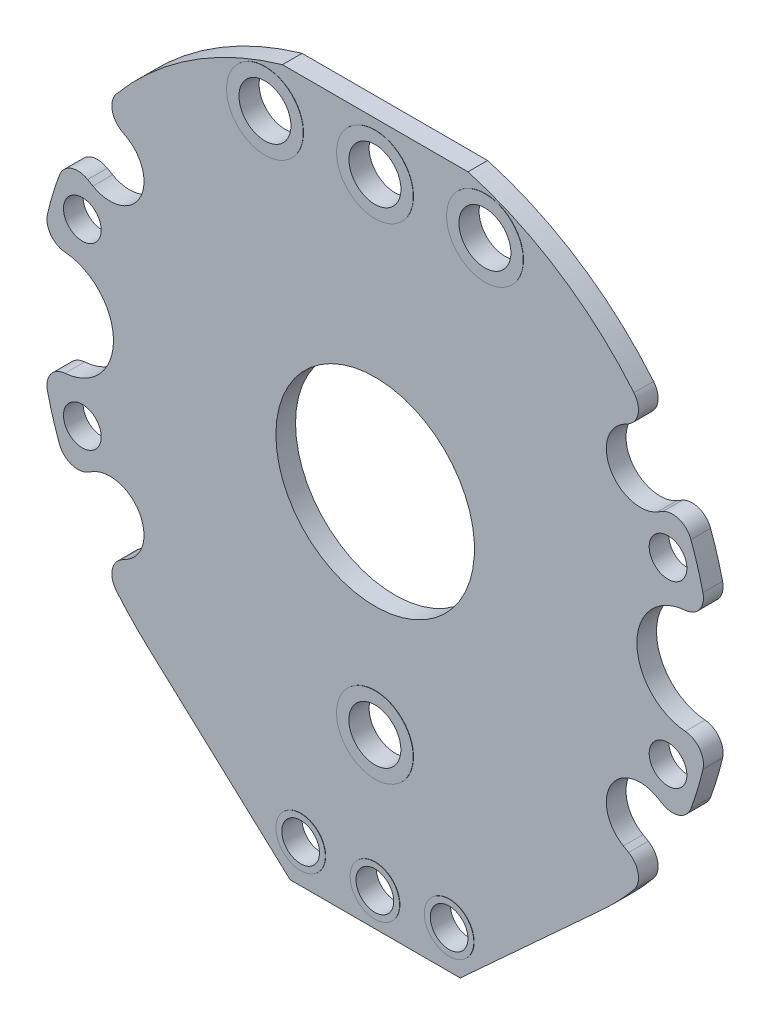
from build123d import *
from build123d.topology import SkipClean

# Parameters (mm, degrees)
BOSS_EXTRUDE1_DEPTH            = 1.5875
CUT_EXTRUDE1_DEPTH             = 46.864987723
CUT_EXTRUDE2_DEPTH             = 46.864987723
CUT_EXTRUDE3_DEPTH             = 46.864987723
CUT_EXTRUDE4_DEPTH             = 46.864987723
SKETCH6_W                      = 3.0988
SKETCH6_H                      = 0.0254
SKETCH10_W                     = 2
SKETCH10_H                     = 0.0254
M14_CLEARANCE_HOLE1_D          = 16.05
M14_CLEARANCE_HOLE1_DEPTH      = 1.6129
F_8_5_8_5_DIAMETER_HOLE1_D     = 8.5
F_8_5_8_5_DIAMETER_HOLE2_D     = 8.5
F_8_5_8_5_DIAMETER_HOLE2_DEPTH = 1.6129
SKETCH17_W                     = 2
SKETCH17_H                     = 0.0254
M2_5_CLEARANCE_HOLE1_D         = 3.048
M3_5_CLEARANCE_HOLE1_D         = 4.2
CHAMFER1_SIZE                  = 9.324286844
FILLET1_R                      = 1.5875
BOSS_EXTRUDE2_START            = 0.02
SKETCH30_R                     = 3.1
SKETCH30_R_2                   = 2.1
BOSS_EXTRUDE2_DEPTH            = 0.02
BOSS_EXTRUDE4_START            = 0.0254
SKETCH33_R                     = 2
SKETCH33_R_2                   = 1.524
BOSS_EXTRUDE4_DEPTH            = 0.0254
SKETCH34_R                     = 2
CUT_EXTRUDE8_DEPTH             = 0.0254
CUT_EXTRUDE9_START             = -0.0254
SKETCH36_R                     = 2
CUT_EXTRUDE9_DEPTH             = 0.0254
BOSS_EXTRUDE5_START            = 0.0254
SKETCH37_R                     = 2
SKETCH37_R_2                   = 1.524
BOSS_EXTRUDE5_DEPTH            = 0.0254
SKETCH38_R                     = 2
SKETCH38_R_2                   = 1.524
BOSS_EXTRUDE6_DEPTH            = 0.02
SKETCH39_R                     = 3.0988
SKETCH39_R_2                   = 2.1
BOSS_EXTRUDE7_DEPTH            = 0.0207


with BuildPart() as part:
    # Sketch1 → Boss-Extrude1 (new body)
    with BuildSketch(Plane(origin=(0, 0, -0.79375), x_dir=(-1, 0, 0), z_dir=(0, 0, -1))):
        with BuildLine():
            Line((-18.376844344, -20.054806456), (0, -36.894081809))
            Line((0, -36.894081809), (18.376844344, -20.054806456))
            ThreePointArc((18.376844344, -20.054806456), (26.47733416, 6.233333445), (7.5, 26.146771695))
            Line((7.5, 26.146771695), (-7.5, 26.146771695))
            ThreePointArc((-7.5, 26.146771695), (-26.47733416, 6.233333445), (-18.376844344, -20.054806456))
        make_face()
    extrude(amount=-BOSS_EXTRUDE1_DEPTH)

    # Sketch2 → Cut-Extrude1 (cut, through all)
    with BuildSketch(Plane.XY.offset(0.79375)):
        with BuildLine():
            Line((-25.071320917, 11.2995074), (-22.809128744, 9.99343014))
            ThreePointArc((-22.809128744, 9.99343014), (-19.052558883, 11), (-20.059128744, 14.75656986))
            Line((-20.059128744, 14.75656986), (-22.321320917, 16.062647121))
            ThreePointArc((-22.321320917, 16.062647121), (-23.815698604, 13.75), (-25.071320917, 11.2995074))
        make_face()
    extrude(amount=-CUT_EXTRUDE1_DEPTH, mode=Mode.SUBTRACT)

    # Sketch3 → Cut-Extrude2 (cut, through all)
    with BuildSketch(Plane.XY.offset(0.79375)):
        with BuildLine():
            Line((22.321320917, 16.062647121), (20.059128744, 14.75656986))
            ThreePointArc((20.059128744, 14.75656986), (19.052558883, 11), (22.809128744, 9.99343014))
            Line((22.809128744, 9.99343014), (25.071320917, 11.2995074))
            ThreePointArc((25.071320917, 11.2995074), (23.815698604, 13.75), (22.321320917, 16.062647121))
        make_face()
    extrude(amount=-CUT_EXTRUDE2_DEPTH, mode=Mode.SUBTRACT)

    # Sketch4 → Cut-Extrude3 (cut, through all)
    with BuildSketch(Plane.XY.offset(0.79375)):
        with BuildLine():
            Line((25.071320917, -11.2995074), (22.809128744, -9.99343014))
            ThreePointArc((22.809128744, -9.99343014), (19.052558883, -11), (20.059128744, -14.75656986))
            Line((20.059128744, -14.75656986), (22.321320917, -16.062647121))
            ThreePointArc((22.321320917, -16.062647121), (23.815698604, -13.75), (25.071320917, -11.2995074))
        make_face()
    extrude(amount=-CUT_EXTRUDE3_DEPTH, mode=Mode.SUBTRACT)

    # Sketch5 → Cut-Extrude4 (cut, through all)
    with BuildSketch(Plane.XY.offset(0.79375)):
        with BuildLine():
            Line((-22.321320917, -16.062647121), (-20.059128744, -14.75656986))
            ThreePointArc((-20.059128744, -14.75656986), (-19.052558883, -11), (-22.809128744, -9.99343014))
            Line((-22.809128744, -9.99343014), (-25.071320917, -11.2995074))
            ThreePointArc((-25.071320917, -11.2995074), (-23.815698604, -13.75), (-22.321320917, -16.062647121))
        make_face()
    extrude(amount=-CUT_EXTRUDE4_DEPTH, mode=Mode.SUBTRACT)

    # Sketch6 → Revolve1 (revolve)
    with BuildSketch(Plane.XZ.offset(17), mode=Mode.PRIVATE) as revolve1_sk:
        with Locations((1.5494, 0.80645)):
            Rectangle(SKETCH6_W, SKETCH6_H)
    revolve(revolve1_sk.sketch.rotate(Axis((0, -17, 0.81915), (0, 0, -1)), 180), axis=Axis((0, -17, 0.81915), (0, 0, -1)))

    # Sketch10 → Revolve5 (revolve)
    with BuildSketch(Plane.XZ.offset(28.575), mode=Mode.PRIVATE) as revolve5_sk:
        with Locations((1, 0.80645)):
            Rectangle(SKETCH10_W, SKETCH10_H)
    revolve(revolve5_sk.sketch.rotate(Axis((0, -28.575, 0.81915), (0, 0, -1)), 180), axis=Axis((0, -28.575, 0.81915), (0, 0, -1)))

    # M14 Clearance Hole1
    with Locations(Plane(origin=(0, 0, -0.79375), x_dir=(-1, 0, 0), z_dir=(0, 0, -1))):
        with Locations((0, 0)):
            Hole(M14_CLEARANCE_HOLE1_D / 2, depth=M14_CLEARANCE_HOLE1_DEPTH)

    # Ø8.5 (8.5) Diameter Hole1 (through all)
    with Locations(Plane.XY.offset(0.79375)):
        with Locations((-25.4, 0)):
            Hole(F_8_5_8_5_DIAMETER_HOLE1_D / 2)

    # Ø8.5 (8.5) Diameter Hole2
    with Locations(Plane(origin=(0, 0, -0.79375), x_dir=(-1, 0, 0), z_dir=(0, 0, -1))):
        with Locations((-25.4, 0)):
            Hole(F_8_5_8_5_DIAMETER_HOLE2_D / 2, depth=F_8_5_8_5_DIAMETER_HOLE2_DEPTH)

    # Sketch17 → Revolve12 (revolve)
    with BuildSketch(Plane.XZ.offset(28.575), mode=Mode.PRIVATE) as revolve12_sk:
        with Locations((1, -0.80645)):
            Rectangle(SKETCH17_W, SKETCH17_H)
    revolve(revolve12_sk.sketch.rotate(Axis((0, -28.575, -0.79375), (0, 0, -1)), 180), axis=Axis((0, -28.575, -0.79375), (0, 0, -1)))

    # M2.5 Clearance Hole1 (through all)
    with Locations(Plane(origin=(0, 0, -0.81915), x_dir=(-1, 0, 0), z_dir=(0, 0, -1))):
        with Locations((0, -27.9), (-6, -27.5), (6, -27.5), (23.66854271, 7.236199692), (23.66854271, -7.236199692), (-23.66854271, -7.236199692), (-23.66854271, 7.236199692)):
            Hole(M2_5_CLEARANCE_HOLE1_D / 2)

    # M3.5 Clearance Hole1 (through all)
    with Locations(Plane(origin=(0, 0, -0.79375), x_dir=(-1, 0, 0), z_dir=(0, 0, -1))):
        with Locations((-8.89, 22.225), (8.89, 22.225), (0, 22.225), (0, -17)):
            Hole(M3_5_CLEARANCE_HOLE1_D / 2)

    # Chamfer1
    chamfer1_edges = [part.edges().sort_by_distance(p)[0] for p in [
        (0, -36.894081809, 0),
    ]]
    chamfer(chamfer1_edges, length=CHAMFER1_SIZE)

    # Fillet1
    fillet1_edges = [part.edges().sort_by_distance(p)[0] for p in [
        (-26.909471851, 3.972907591, 0),
        (-26.909471851, -3.972907591, 0),
        (26.909471851, -3.972907591, 0),
        (26.909471851, 3.972907591, 0),
        (-22.061208685, 15.912471254, 0),
        (-24.811208685, 11.149331533, 0),
        (24.811208685, 11.149331533, 0),
        (22.061208685, 15.912471254, 0),
        (22.061208685, -15.912471254, 0),
        (24.811208685, -11.149331533, 0),
        (-24.811208685, -11.149331533, 0),
        (-22.061208685, -15.912471254, 0),
    ]]
    fillet(fillet1_edges, radius=FILLET1_R)

    # Sketch30 → Boss-Extrude2 (add)
    # profile 1 of 3: a face of its own
    with BuildSketch(Plane.XY.offset(0.79375).offset(BOSS_EXTRUDE2_START)):
        with Locations(Location((-8.89, 22.225, 0), (0, 0, 180))):
            Circle(SKETCH30_R)
        with Locations(Location((-8.89, 22.225, 0), (0, 0, 180))):
            Circle(SKETCH30_R_2, mode=Mode.SUBTRACT)
    # profile 2 of 3: a face of its own
    with BuildSketch(Plane.XY.offset(0.79375).offset(BOSS_EXTRUDE2_START)):
        with Locations(Location((0, 22.225, 0), (0, 0, 180))):
            Circle(SKETCH30_R)
        with Locations(Location((0, 22.225, 0), (0, 0, 180))):
            Circle(SKETCH30_R_2, mode=Mode.SUBTRACT)
    # profile 3 of 3: a face of its own
    with BuildSketch(Plane.XY.offset(0.79375).offset(BOSS_EXTRUDE2_START)):
        with Locations(Location((8.89, 22.225, 0), (0, 0, 180))):
            Circle(SKETCH30_R)
        with Locations(Location((8.89, 22.225, 0), (0, 0, 180))):
            Circle(SKETCH30_R_2, mode=Mode.SUBTRACT)
    boss_extrude2 = extrude(amount=-BOSS_EXTRUDE2_DEPTH)

    # Mirror1: Boss-Extrude2 across plane
    add(boss_extrude2.mirror(Plane.XY))

    # Sketch33 → Boss-Extrude4 (add)
    # profile 1 of 2: a face of its own
    with BuildSketch(Plane.XY.offset(0.79375).offset(BOSS_EXTRUDE4_START)):
        with Locations(Location((-6, -27.5, 0), (0, 0, 180))):
            Circle(SKETCH33_R)
        with Locations(Location((-6, -27.5, 0), (0, 0, 180))):
            Circle(SKETCH33_R_2, mode=Mode.SUBTRACT)
    # profile 2 of 2: a face of its own
    with BuildSketch(Plane.XY.offset(0.79375).offset(BOSS_EXTRUDE4_START)):
        with Locations(Location((6, -27.5, 0), (0, 0, 180))):
            Circle(SKETCH33_R)
        with Locations(Location((6, -27.5, 0), (0, 0, 180))):
            Circle(SKETCH33_R_2, mode=Mode.SUBTRACT)
    extrude(amount=-BOSS_EXTRUDE4_DEPTH)

    # Sketch34 → Cut-Extrude8 (cut)
    with BuildSketch(Plane(origin=(0, 0, 0.81915), x_dir=(-1, 0, 0), z_dir=(0, 0, -1))):
        with Locations((0, -28.575)):
            Circle(SKETCH34_R)
    extrude(amount=CUT_EXTRUDE8_DEPTH, mode=Mode.SUBTRACT)

    # Sketch36 → Cut-Extrude9 (cut)
    with BuildSketch(Plane(origin=(0, 0, -0.81915), x_dir=(-1, 0, 0), z_dir=(0, 0, -1)).offset(CUT_EXTRUDE9_START)):
        with Locations((0, -28.575)):
            Circle(SKETCH36_R)
    extrude(amount=CUT_EXTRUDE9_DEPTH, mode=Mode.SUBTRACT)

    # Sketch37 → Boss-Extrude5 (add)
    with BuildSketch(Plane.XY.offset(0.79375).offset(BOSS_EXTRUDE5_START)):
        with Locations(Location((0, -27.9, 0), (0, 0, 180))):
            Circle(SKETCH37_R)
        with Locations(Location((0, -27.9, 0), (0, 0, 180))):
            Circle(SKETCH37_R_2, mode=Mode.SUBTRACT)
    extrude(amount=-BOSS_EXTRUDE5_DEPTH)

    # Sketch38 → Boss-Extrude6 (add)
    # profile 1 of 3: a face of its own
    with SkipClean():  # the faces are left unmerged after this step: merging them gives an invalid solid
        with BuildSketch(Plane(origin=(0, 0, -0.79375), x_dir=(-1, 0, 0), z_dir=(0, 0, -1))):
            with Locations((0, -27.9)):
                Circle(SKETCH38_R)
            with Locations((0, -27.9)):
                Circle(SKETCH38_R_2, mode=Mode.SUBTRACT)
        # profile 2 of 3: a face of its own
        with BuildSketch(Plane(origin=(0, 0, -0.79375), x_dir=(-1, 0, 0), z_dir=(0, 0, -1))):
            with Locations((6, -27.5)):
                Circle(SKETCH38_R)
            with Locations((6, -27.5)):
                Circle(SKETCH38_R_2, mode=Mode.SUBTRACT)
        # profile 3 of 3: a face of its own
        with BuildSketch(Plane(origin=(0, 0, -0.79375), x_dir=(-1, 0, 0), z_dir=(0, 0, -1))):
            with Locations((-6, -27.5)):
                Circle(SKETCH38_R)
            with Locations((-6, -27.5)):
                Circle(SKETCH38_R_2, mode=Mode.SUBTRACT)
        extrude(amount=BOSS_EXTRUDE6_DEPTH)

    # Sketch39 → Boss-Extrude7 (add)
    with SkipClean():  # the faces are left unmerged after this step: merging them gives an invalid solid
        with BuildSketch(Plane(origin=(0, 0, -0.79375), x_dir=(-1, 0, 0), z_dir=(0, 0, -1))):
            with Locations((0, -17)):
                Circle(SKETCH39_R)
            with Locations((0, -17)):
                Circle(SKETCH39_R_2, mode=Mode.SUBTRACT)
        extrude(amount=BOSS_EXTRUDE7_DEPTH)


solid = part.part
